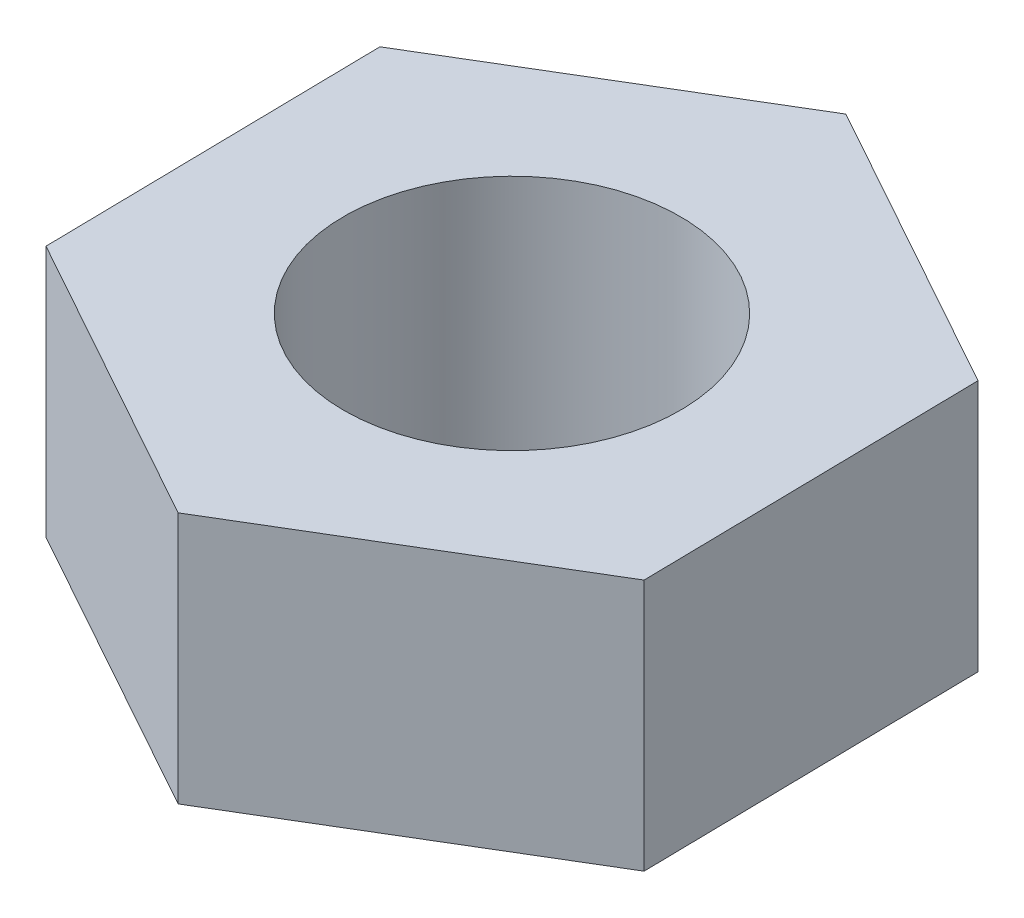
from build123d import *

# Parameters (mm, degrees)
SKETCH1_R           = 2
BOSS_EXTRUDE1_DEPTH = 3


with BuildPart() as part:
    # Sketch1 → Boss-Extrude1 (new body)
    with BuildSketch(Plane(origin=(0, 0, 0), x_dir=(1, 0, 0), z_dir=(0, 1, 0))):
        Polygon((3.4655164, 2.07930984), (-0.067976944, 4.04088016), (-3.533493344, 1.96157032), (-3.4655164, -2.07930984), (0.067976944, -4.04088016), (3.533493344, -1.96157032), align=None)
        with Locations(Location((0, 0, 0), (0, 0, 270))):
            Circle(SKETCH1_R, mode=Mode.SUBTRACT)
    extrude(amount=BOSS_EXTRUDE1_DEPTH)


solid = part.part
